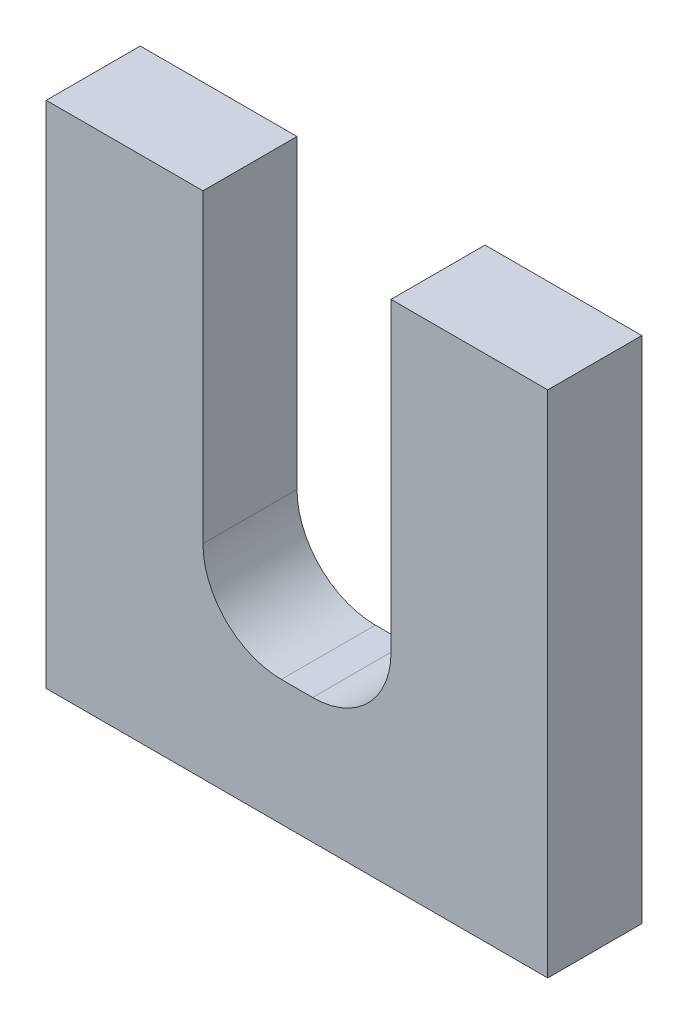
from build123d import *

# Parameters (mm, degrees)
BOSS_EXTRUDE1_DEPTH = 1.5


with BuildPart() as part:
    # Sketch1 → Boss-Extrude1 (new, symmetric)
    with BuildSketch(Plane.XY):
        with BuildLine():
            Line((8, -8.125), (-8, -8.125))
            Line((-8, -8.125), (-8, 8.125))
            Line((-8, 8.125), (-3, 8.125))
            Line((-3, 8.125), (-3, -1.625))
            ThreePointArc((-3, -1.625), (-2.267766953, -3.392766953), (-0.5, -4.125))
            Line((-0.5, -4.125), (0.5, -4.125))
            ThreePointArc((0.5, -4.125), (2.267766953, -3.392766953), (3, -1.625))
            Line((3, -1.625), (3, 8.125))
            Line((3, 8.125), (8, 8.125))
            Line((8, 8.125), (8, -8.125))
        make_face()
    extrude(amount=BOSS_EXTRUDE1_DEPTH, both=True)


solid = part.part
